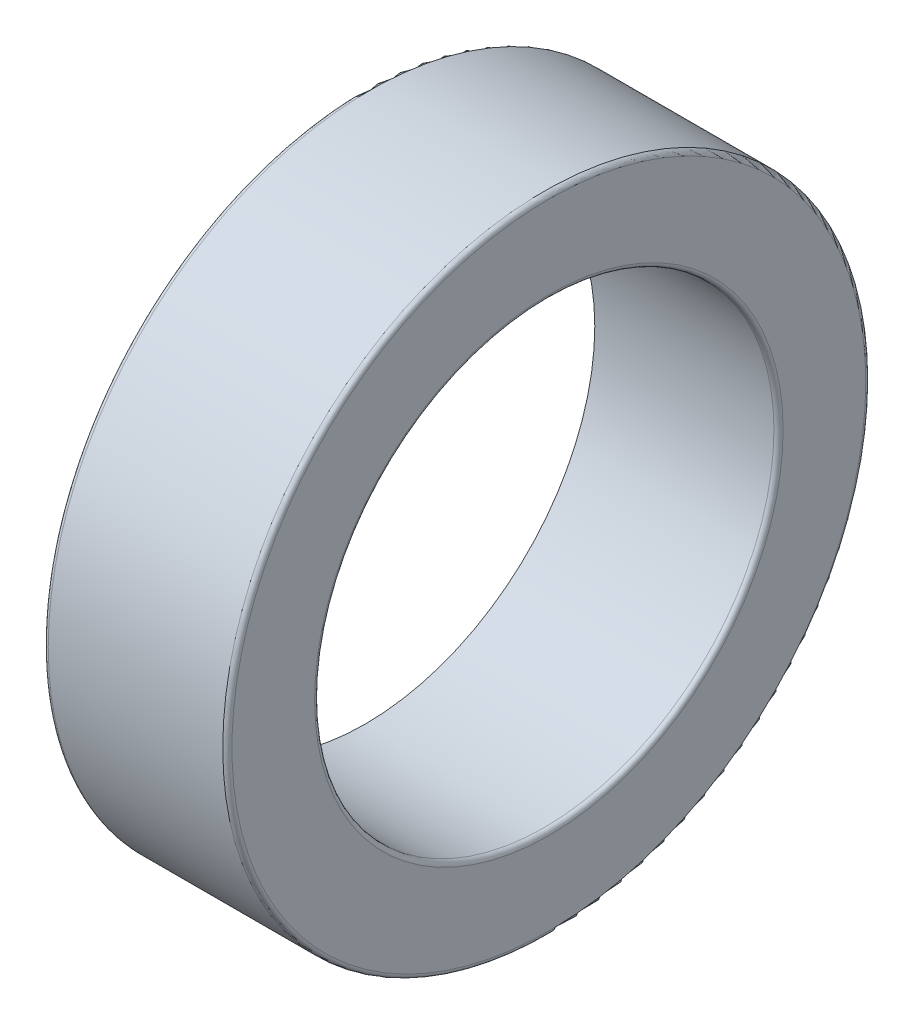
from build123d import *

# Parameters (mm, degrees)
SKETCH1_R           = 88.9
SKETCH1_R_2         = 63.5
BOSS_EXTRUDE1_DEPTH = 25.4
FILLET1_R           = 1.27


with BuildPart() as part:
    # Sketch1 → Boss-Extrude1 (new, symmetric)
    with BuildSketch(Plane(origin=(0, 0, 0), x_dir=(0, 0, -1), z_dir=(1, 0, 0))):
        Circle(SKETCH1_R)
        Circle(SKETCH1_R_2, mode=Mode.SUBTRACT)
    extrude(amount=BOSS_EXTRUDE1_DEPTH, both=True)

    # Fillet1
    fillet1_edges = [part.edges().sort_by_distance(p)[0] for p in [
        (-25.4, 0, 88.9),
        (25.4, 0, 88.9),
        (25.4, 0, 63.5),
    ]]
    fillet(fillet1_edges, radius=FILLET1_R)


solid = part.part
